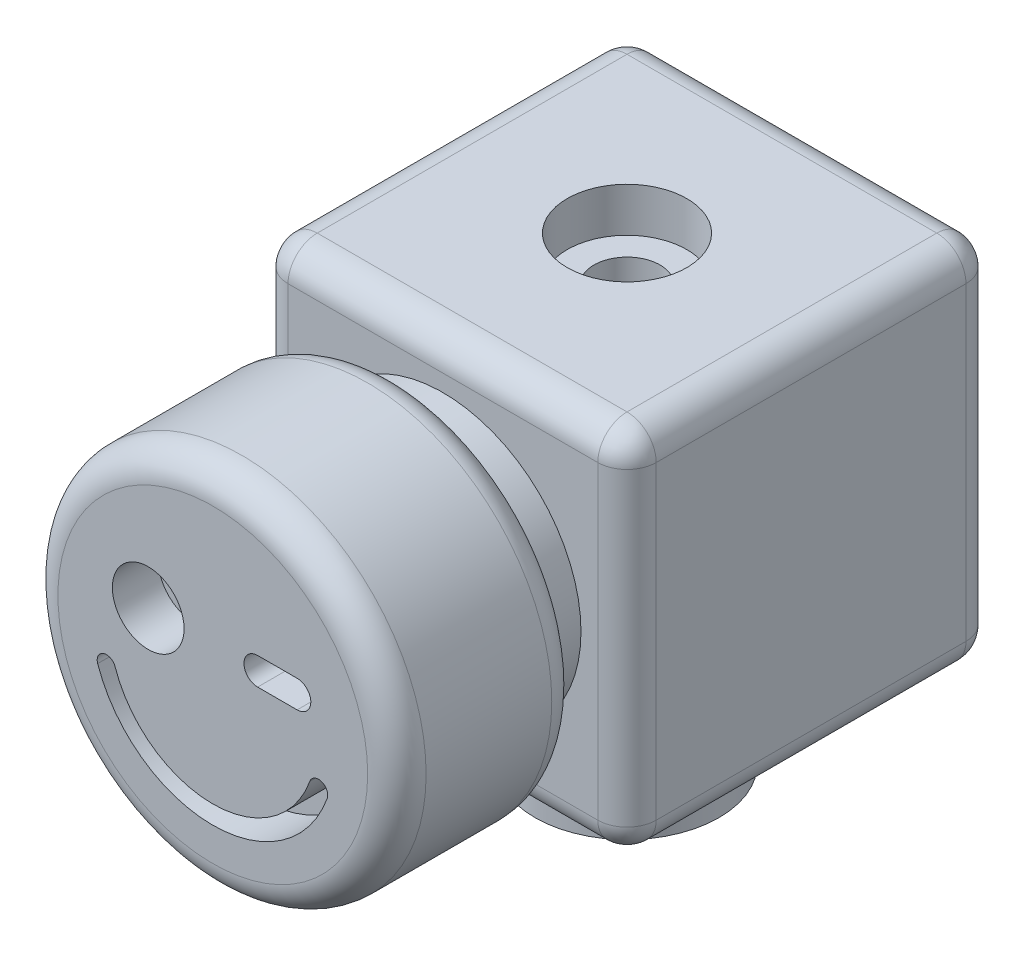
from build123d import *

# Parameters (mm, degrees)
SKETCH1_R                                            = 5
BOSS_EXTRUDE1_DEPTH                                  = 5
SKETCH2_W                                            = 20
SKETCH2_H                                            = 20
BOSS_EXTRUDE2_DEPTH                                  = 20
SKETCH3_R                                            = 7.5
BOSS_EXTRUDE4_DEPTH                                  = 2.5
SKETCH4_R                                            = 10
BOSS_EXTRUDE5_DEPTH                                  = 10
CBORE_FOR_M3_HEX_SOCKET_THIN_HEAD_CAP_SC_D           = 3.6
CBORE_FOR_M3_HEX_SOCKET_THIN_HEAD_CAP_SC_CBORE_D     = 6.5
CBORE_FOR_M3_HEX_SOCKET_THIN_HEAD_CAP_SC_CBORE_DEPTH = 2.4
FILLET1_R                                            = 1.5875
SKETCH7_R                                            = 1.948257307
CUT_EXTRUDE2_DEPTH                                   = 2.5


with BuildPart() as part:
    # Sketch1 → Boss-Extrude1 (new body)
    with BuildSketch(Plane(origin=(0, 0, 0), x_dir=(1, 0, 0), z_dir=(0, 1, 0))):
        with Locations(Location((0, 0, 0), (0, 0, 270))):
            Circle(SKETCH1_R)
    extrude(amount=BOSS_EXTRUDE1_DEPTH)

    # Sketch2 → Boss-Extrude2 (add)
    with BuildSketch(Plane(origin=(0, 5, 0), x_dir=(1, 0, 0), z_dir=(0, 1, 0))):
        Rectangle(SKETCH2_W, SKETCH2_H)
    extrude(amount=BOSS_EXTRUDE2_DEPTH)

    # Sketch3 → Boss-Extrude4 (add)
    with BuildSketch(Plane.XY.offset(10)):
        with Locations((0, 15)):
            Circle(SKETCH3_R)
    extrude(amount=BOSS_EXTRUDE4_DEPTH)

    # Sketch4 → Boss-Extrude5 (add)
    with BuildSketch(Plane.XY.offset(12.5)):
        with Locations((0, 15)):
            Circle(SKETCH4_R)
    extrude(amount=BOSS_EXTRUDE5_DEPTH)

    # CBORE for M3 Hex Socket Thin Head Cap Screw1 (through all)
    with Locations(Plane(origin=(0, 25, 0), x_dir=(1, 0, 0), z_dir=(0, 1, 0))):
        with Locations((0, 0)):
            CounterBoreHole(CBORE_FOR_M3_HEX_SOCKET_THIN_HEAD_CAP_SC_D / 2, CBORE_FOR_M3_HEX_SOCKET_THIN_HEAD_CAP_SC_CBORE_D / 2, CBORE_FOR_M3_HEX_SOCKET_THIN_HEAD_CAP_SC_CBORE_DEPTH)

    # Fillet1
    fillet1_edges = [part.edges().sort_by_distance(p)[0] for p in [
        (-10, 15, 12.5),
        (-10, 15, 22.5),
        (10, 5, 0),
        (10, 15, 10),
        (0, 5, -10),
        (10, 15, -10),
        (-10, 5, 0),
        (-10, 15, -10),
        (0, 5, 10),
        (-10, 15, 10),
        (10, 25, 0),
        (0, 25, -10),
        (-10, 25, 0),
        (0, 25, 10),
    ]]
    fillet(fillet1_edges, radius=FILLET1_R)

    # Sketch7 → Cut-Extrude2 (cut)
    with BuildSketch(Plane.XY.offset(22.5)):
        with Locations((-3.508388237, 16.85452893)):
            Circle(SKETCH7_R)
        with BuildLine():
            Line((2.435234188, 17.597481733), (4.581542286, 17.597481733))
            ThreePointArc((4.581542286, 17.597481733), (5.32449509, 16.85452893), (4.581542286, 16.111576127))
            Line((4.581542286, 16.111576127), (2.435234188, 16.111576127))
            ThreePointArc((2.435234188, 16.111576127), (1.692281385, 16.85452893), (2.435234188, 17.597481733))
        make_face()
        with BuildLine():
            ThreePointArc((-6.253186094, 12.871476402), (-0.060422297, 8.394752224), (6.213201069, 12.757438628))
            ThreePointArc((6.213201069, 12.757438628), (5.912646592, 13.397490974), (5.272594245, 13.096936498))
            ThreePointArc((5.272594245, 13.096936498), (-0.05127506, 9.394710388), (-5.306526, 13.193710271))
            ThreePointArc((-5.306526, 13.193710271), (-5.940972981, 13.505923383), (-6.253186094, 12.871476402))
        make_face()
    extrude(amount=-CUT_EXTRUDE2_DEPTH, mode=Mode.SUBTRACT)


solid = part.part
